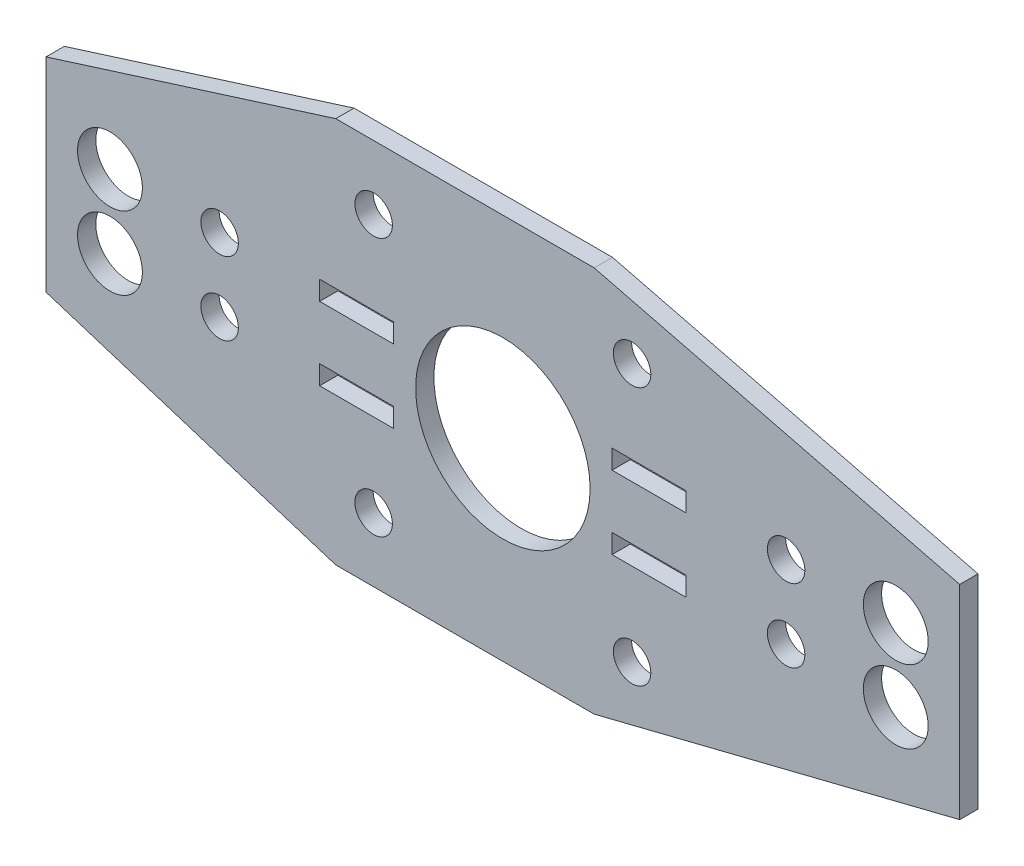
from build123d import *

# Parameters (mm, degrees)
SKETCH_1_R      = 2.05
SKETCH_1_R_2    = 3.55
SKETCH_1_R_3    = 9.55
SKETCH_1_W      = 8.1
SKETCH_1_H      = 2.1
EXTRUDE_1_DEPTH = 2


with BuildPart() as part:
    # 草图1 → 凸台-拉伸1 (new body)
    with BuildSketch(Plane.XY):
        Polygon((81, -15.149736791), (81, 7.149736791), (40.992999038, 17.149736791), (12.70872779, 17.149736791), (-19, 7.149736791), (-19, -15.149736791), (12.70872779, -25.149736791), (40.992999038, -25.149736791), align=None)
        Circle(SKETCH_1_R, mode=Mode.SUBTRACT)
        with Locations((62, 0)):
            Circle(SKETCH_1_R, mode=Mode.SUBTRACT)
        with Locations((62, -8)):
            Circle(SKETCH_1_R, mode=Mode.SUBTRACT)
        with Locations((0, -8)):
            Circle(SKETCH_1_R, mode=Mode.SUBTRACT)
        with Locations((45.142135624, 10.142135624)):
            Circle(SKETCH_1_R, mode=Mode.SUBTRACT)
        with Locations((45.142135624, -18.142135624)):
            Circle(SKETCH_1_R, mode=Mode.SUBTRACT)
        with Locations((16.857864376, -18.142135624)):
            Circle(SKETCH_1_R, mode=Mode.SUBTRACT)
        with Locations((16.857864376, 10.142135624)):
            Circle(SKETCH_1_R, mode=Mode.SUBTRACT)
        with Locations((74, 0)):
            Circle(SKETCH_1_R_2, mode=Mode.SUBTRACT)
        with Locations((74, -8)):
            Circle(SKETCH_1_R_2, mode=Mode.SUBTRACT)
        with Locations((-12, -8)):
            Circle(SKETCH_1_R_2, mode=Mode.SUBTRACT)
        with Locations((-12, 0)):
            Circle(SKETCH_1_R_2, mode=Mode.SUBTRACT)
        with Locations((31, -4)):
            Circle(SKETCH_1_R_3, mode=Mode.SUBTRACT)
        with Locations((15, 0)):
            Rectangle(SKETCH_1_W, SKETCH_1_H, mode=Mode.SUBTRACT)
        with Locations((47, 0)):
            Rectangle(SKETCH_1_W, SKETCH_1_H, mode=Mode.SUBTRACT)
        with Locations((47, -8)):
            Rectangle(SKETCH_1_W, SKETCH_1_H, mode=Mode.SUBTRACT)
        with Locations((15, -8)):
            Rectangle(SKETCH_1_W, SKETCH_1_H, mode=Mode.SUBTRACT)
    extrude(amount=EXTRUDE_1_DEPTH)


solid = part.part
